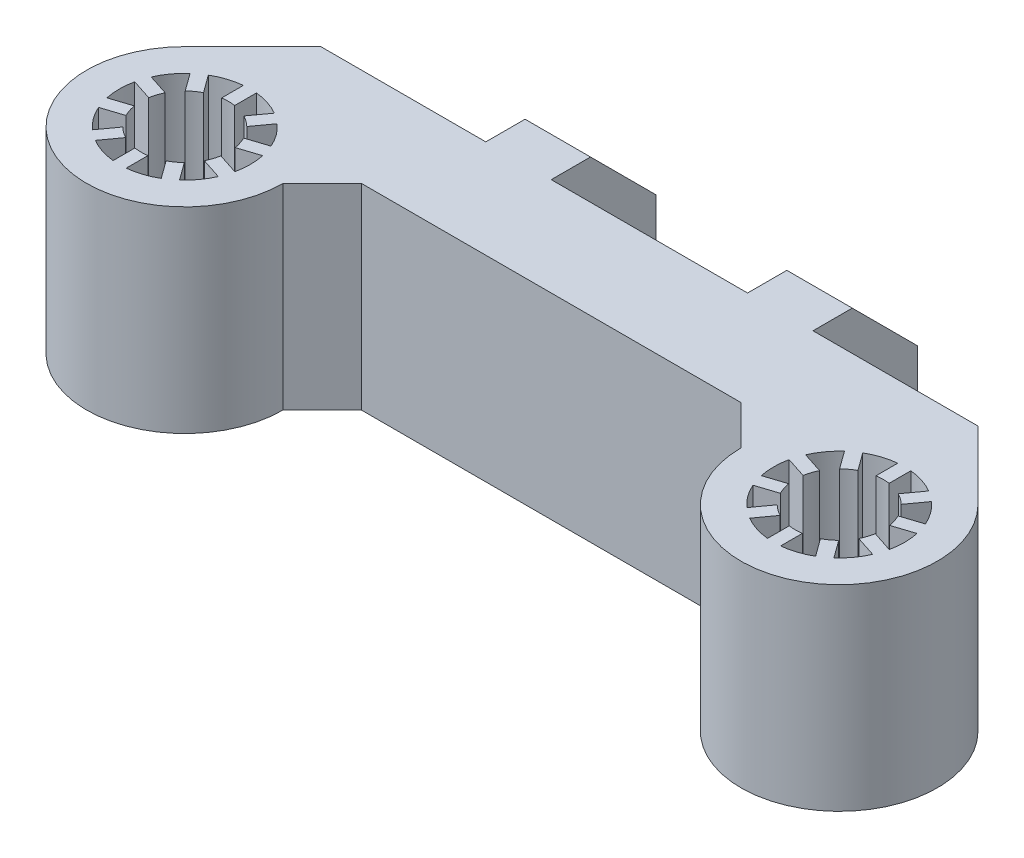
from build123d import *

# Parameters (mm, degrees)
SKETCH1_R                      = 7.5
SKETCH1_R_2                    = 5
SKETCH1_W                      = 5
SKETCH1_H                      = 8
BOSS_EXTRUDE1_DEPTH            = 15
CHAMFER1_SIZE                  = 5
CUT_EXTRUDE1_REACH             = 42.293
SKETCH3_R                      = 2
CUT_EXTRUDE1_DIRECTION_2_REACH = 42.293


with BuildPart() as part:
    # Sketch1 → Boss-Extrude1 (new body)
    # profile 1 of 13: a face of its own
    with BuildSketch(Plane(origin=(0, 0, 0), x_dir=(1, 0, 0), z_dir=(0, 1, 0))):
        with Locations((-25, 0)):
            Circle(SKETCH1_R)
        with Locations((-25, 0)):
            Circle(SKETCH1_R_2, mode=Mode.SUBTRACT)
    # profile 2 of 13: a face of its own
    with BuildSketch(Plane(origin=(0, 0, 0), x_dir=(1, 0, 0), z_dir=(0, 1, 0))):
        with BuildLine():
            Line((-27.995843782, 1.499139764), (-29.576937931, 2.012868394))
            ThreePointArc((-29.576937931, 2.012868394), (-29.755282581, 1.545084972), (-29.885954926, 1.061811878))
            Line((-29.885954926, 1.061811878), (-28.304860777, 0.548083248))
            ThreePointArc((-28.304860777, 0.548083248), (-28.18603933, 1.035206931), (-27.995843782, 1.499139764))
        make_face()
    # profile 3 of 13: a face of its own
    with BuildSketch(Plane(origin=(0, 0, 0), x_dir=(1, 0, 0), z_dir=(0, 1, 0))):
        with BuildLine():
            Line((-28.304860777, -0.548083248), (-29.885954926, -1.061811878))
            ThreePointArc((-29.885954926, -1.061811878), (-29.755282581, -1.545084972), (-29.576937931, -2.012868394))
            Line((-29.576937931, -2.012868394), (-27.995843782, -1.499139764))
            ThreePointArc((-27.995843782, -1.499139764), (-28.18603933, -1.035206931), (-28.304860777, -0.548083248))
        make_face()
    # profile 4 of 13: a face of its own
    with BuildSketch(Plane(origin=(0, 0, 0), x_dir=(1, 0, 0), z_dir=(0, 1, 0))):
        with BuildLine():
            Line((-27.351533282, -2.385957087), (-28.328703206, -3.730916103))
            ThreePointArc((-28.328703206, -3.730916103), (-27.938926261, -4.045084972), (-27.519686212, -4.318701355))
            Line((-27.519686212, -4.318701355), (-26.542516288, -2.973742339))
            ThreePointArc((-26.542516288, -2.973742339), (-26.969080595, -2.710206931), (-27.351533282, -2.385957087))
        make_face()
    # profile 5 of 13: a face of its own
    with BuildSketch(Plane(origin=(0, 0, 0), x_dir=(1, 0, 0), z_dir=(0, 1, 0))):
        with BuildLine():
            Line((-25.5, -3.312476415), (-25.5, -4.974937186))
            ThreePointArc((-25.5, -4.974937186), (-25, -5), (-24.5, -4.974937186))
            Line((-24.5, -4.974937186), (-24.5, -3.312476415))
            ThreePointArc((-24.5, -3.312476415), (-25, -3.35), (-25.5, -3.312476415))
        make_face()
    # profile 6 of 13: a face of its own
    with BuildSketch(Plane(origin=(0, 0, 0), x_dir=(1, 0, 0), z_dir=(0, 1, 0))):
        with BuildLine():
            ThreePointArc((-22.480313788, -4.318701355), (-22.061073739, -4.045084972), (-21.671296794, -3.730916103))
            Line((-21.671296794, -3.730916103), (-22.648466718, -2.385957087))
            ThreePointArc((-22.648466718, -2.385957087), (-23.030919405, -2.710206931), (-23.457483712, -2.973742339))
            Line((-23.457483712, -2.973742339), (-22.480313788, -4.318701355))
        make_face()
    # profile 7 of 13: a face of its own
    with BuildSketch(Plane(origin=(0, 0, 0), x_dir=(1, 0, 0), z_dir=(0, 1, 0))):
        with BuildLine():
            ThreePointArc((-20.423062069, -2.012868394), (-20.244717419, -1.545084972), (-20.114045074, -1.061811878))
            Line((-20.114045074, -1.061811878), (-21.695139223, -0.548083248))
            ThreePointArc((-21.695139223, -0.548083248), (-21.81396067, -1.035206931), (-22.004156218, -1.499139764))
            Line((-22.004156218, -1.499139764), (-20.423062069, -2.012868394))
        make_face()
    # profile 8 of 13: a face of its own
    with BuildSketch(Plane(origin=(0, 0, 0), x_dir=(1, 0, 0), z_dir=(0, 1, 0))):
        with BuildLine():
            ThreePointArc((-20.114045074, 1.061811878), (-20.244717419, 1.545084972), (-20.423062069, 2.012868394))
            Line((-20.423062069, 2.012868394), (-22.004156218, 1.499139764))
            ThreePointArc((-22.004156218, 1.499139764), (-21.81396067, 1.035206931), (-21.695139223, 0.548083248))
            Line((-21.695139223, 0.548083248), (-20.114045074, 1.061811878))
        make_face()
    # profile 9 of 13: a face of its own
    with BuildSketch(Plane(origin=(0, 0, 0), x_dir=(1, 0, 0), z_dir=(0, 1, 0))):
        with BuildLine():
            ThreePointArc((-21.671296794, 3.730916103), (-22.061073739, 4.045084972), (-22.480313788, 4.318701355))
            Line((-22.480313788, 4.318701355), (-23.457483712, 2.973742339))
            ThreePointArc((-23.457483712, 2.973742339), (-23.030919405, 2.710206931), (-22.648466718, 2.385957087))
            Line((-22.648466718, 2.385957087), (-21.671296794, 3.730916103))
        make_face()
    # profile 10 of 13: a face of its own
    with BuildSketch(Plane(origin=(0, 0, 0), x_dir=(1, 0, 0), z_dir=(0, 1, 0))):
        with BuildLine():
            ThreePointArc((-24.5, 4.974937186), (-25, 5), (-25.5, 4.974937186))
            Line((-25.5, 4.974937186), (-25.5, 3.312476415))
            ThreePointArc((-25.5, 3.312476415), (-25, 3.35), (-24.5, 3.312476415))
            Line((-24.5, 3.312476415), (-24.5, 4.974937186))
        make_face()
    # profile 11 of 13: a face of its own
    with BuildSketch(Plane(origin=(0, 0, 0), x_dir=(1, 0, 0), z_dir=(0, 1, 0))):
        with BuildLine():
            Line((-26.542516288, 2.973742339), (-27.519686212, 4.318701355))
            ThreePointArc((-27.519686212, 4.318701355), (-27.938926261, 4.045084972), (-28.328703206, 3.730916103))
            Line((-28.328703206, 3.730916103), (-27.351533282, 2.385957087))
            ThreePointArc((-27.351533282, 2.385957087), (-26.969080595, 2.710206931), (-26.542516288, 2.973742339))
        make_face()
    # profile 12 of 13: a face of its own
    with BuildSketch(Plane(origin=(0, 0, 0), x_dir=(1, 0, 0), z_dir=(0, 1, 0))):
        with BuildLine():
            Line((-25.106601718, 10.5), (-30.303300859, 5.303300859))
            ThreePointArc((-30.303300859, 5.303300859), (-22.129874257, 6.929096494), (-17.5, 0))
            Line((-17.5, 0), (-14.5, 3))
            Line((-14.5, 3), (0, 3))
            Line((0, 3), (0, 10.5))
            Line((0, 10.5), (-7.5, 10.5))
            Line((-7.5, 10.5), (-12.5, 10.5))
            Line((-12.5, 10.5), (-25.106601718, 10.5))
        make_face()
    # profile 13 of 13: a face of its own
    with BuildSketch(Plane(origin=(0, 0, 0), x_dir=(1, 0, 0), z_dir=(0, 1, 0))):
        with Locations((-10, 14.5)):
            Rectangle(SKETCH1_W, SKETCH1_H)
    boss_extrude1 = extrude(amount=BOSS_EXTRUDE1_DEPTH)

    # Mirror1: Boss-Extrude1 across plane
    add(boss_extrude1.mirror(Plane(origin=(0, 0, 0), x_dir=(0, 0, 1), z_dir=(1, 0, 0))))

    # Chamfer1
    chamfer1_edges = [part.edges().sort_by_distance(p)[0] for p in [
        (10, 15, -18.5),
        (10, 0, -18.5),
        (-10, 15, -18.5),
        (-10, 0, -18.5),
    ]]
    chamfer(chamfer1_edges, length=CHAMFER1_SIZE)

    # Sketch3 → Cut-Extrude1 (cut, up to next)
    with BuildSketch(Plane(origin=(0, 0, 0), x_dir=(0, 0, -1), z_dir=(1, 0, 0)), mode=Mode.PRIVATE) as cut_extrude1_sk1:
        with Locations(Location((14.5, 7.5, 0), (0, 0, 180))):
            Circle(SKETCH3_R)
    cut_extrude1_tool1 = extrude(cut_extrude1_sk1.sketch, amount=-CUT_EXTRUDE1_REACH, mode=Mode.PRIVATE) & part.part
    add(cut_extrude1_tool1.solids().sort_by_distance((0, 7.5, -14.5))[0], mode=Mode.SUBTRACT)

    # Sketch3 → Cut-Extrude1 direction 2 (cut, up to next)
    with BuildSketch(Plane(origin=(0, 0, 0), x_dir=(0, 0, -1), z_dir=(1, 0, 0)), mode=Mode.PRIVATE) as cut_extrude1_direction_2_sk1:
        with Locations(Location((14.5, 7.5, 0), (0, 0, 180))):
            Circle(SKETCH3_R)
    cut_extrude1_direction_2_tool1 = extrude(cut_extrude1_direction_2_sk1.sketch, amount=CUT_EXTRUDE1_DIRECTION_2_REACH, mode=Mode.PRIVATE) & part.part
    add(cut_extrude1_direction_2_tool1.solids().sort_by_distance((0, 7.5, -14.5))[0], mode=Mode.SUBTRACT)


solid = part.part
